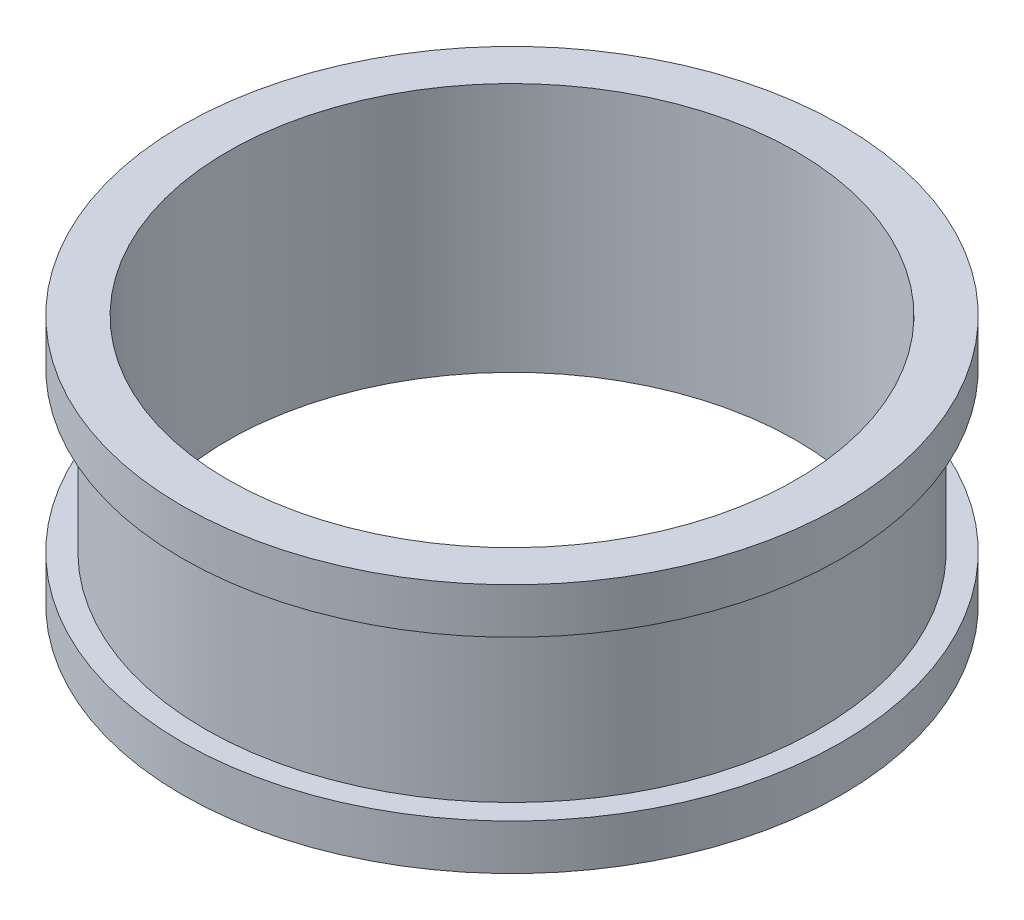
from build123d import *

# Parameters (mm, degrees)
SKETCH1_R           = 14.5
BOSS_EXTRUDE1_DEPTH = 11
SKETCH2_R           = 12.5
CUT_EXTRUDE1_DEPTH  = 24.270152556


with BuildPart() as part:
    # Sketch1 → Boss-Extrude1 (new body)
    with BuildSketch(Plane(origin=(0, 0, 0), x_dir=(1, 0, 0), z_dir=(0, 1, 0))):
        with Locations(Location((0, 0, 0), (0, 0, 270))):
            Circle(SKETCH1_R)
    extrude(amount=BOSS_EXTRUDE1_DEPTH)

    # Sketch2 → Cut-Extrude1 (cut, through all)
    with BuildSketch(Plane.XZ):
        with Locations(Location((0, 0, 0), (0, 0, 270))):
            Circle(SKETCH2_R)
    extrude(amount=-CUT_EXTRUDE1_DEPTH, mode=Mode.SUBTRACT)

    # Sketch3 → Cut-Revolve2 (revolve, cut)
    with BuildSketch(Plane(origin=(0, 0, 0), x_dir=(0, 0, -1), z_dir=(1, 0, 0))):
        Polygon((-14.5, 11), (-14.5, 9), (-13.5, 9), (-13.5, 2), (-14.5, 2), (-14.5, 0), (-16.729305882, 5.995742764), align=None)
    revolve(axis=Axis((0, 11.640939065, 0), (0, -1, 0)), mode=Mode.SUBTRACT)


solid = part.part
